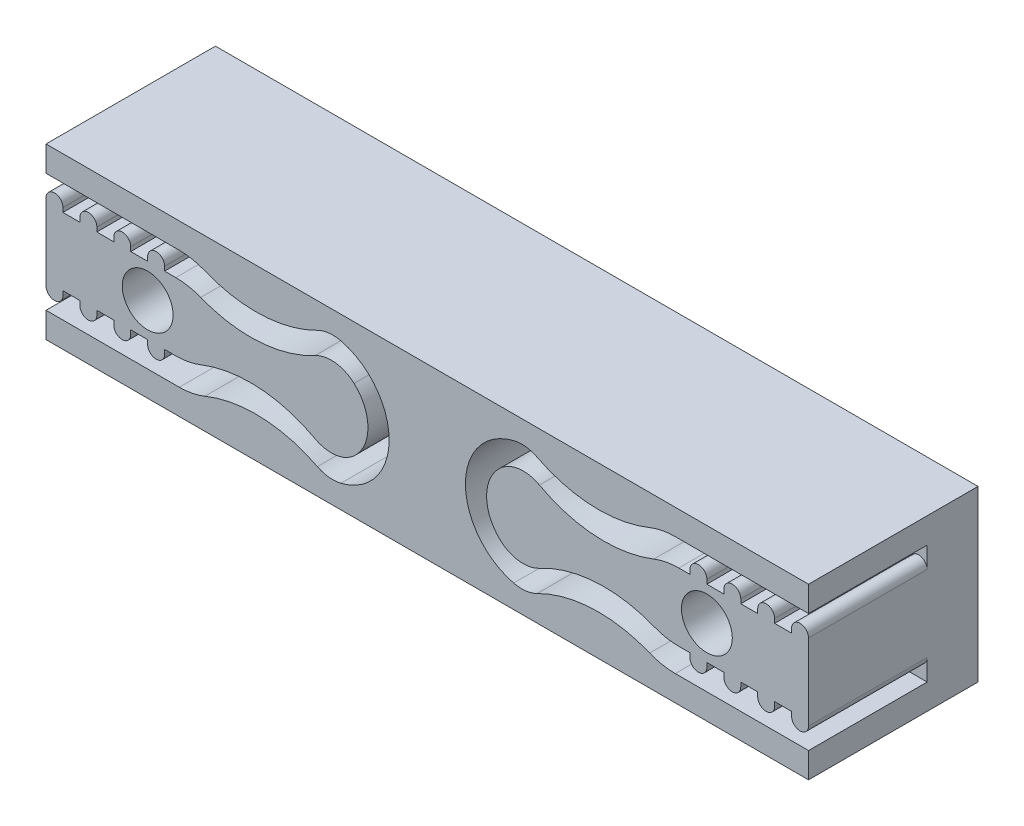
from build123d import *

# Parameters (mm, degrees)
SKETCH_1_W          = 45
SKETCH_1_H          = 8
EXTRUDE_1_DEPTH     = 10
SKETCH_4_W          = 45
SKETCH_4_H          = 10
EXTRUDE_2_DEPTH     = 2
CUT_EXTRUDE_1_DEPTH = 7
SKETCH_7_W          = 1
SKETCH_7_H          = 0.75
EXTRUDE_3_DEPTH     = 7
FILLET_2_RADIUS     = 0.5
FILLET_2_LENGTH     = 7
FILLET_3_RADIUS     = 0.5
FILLET_3_LENGTH     = 7
FILLET_4_RADIUS     = 0.5
FILLET_4_LENGTH     = 7
FILLET_5_RADIUS     = 0.5
FILLET_5_LENGTH     = 7
FILLET_7_RADIUS     = 0.5
FILLET_7_LENGTH     = 7
FILLET_8_RADIUS     = 0.5
FILLET_8_LENGTH     = 7
FILLET_9_RADIUS     = 0.5
FILLET_9_LENGTH     = 7
FILLET_10_RADIUS    = 0.5
FILLET_10_LENGTH    = 7
FILLET_11_RADIUS    = 0.5
FILLET_11_LENGTH    = 7
FILLET_12_RADIUS    = 0.5
FILLET_12_LENGTH    = 7
FILLET_13_RADIUS    = 0.5
FILLET_13_LENGTH    = 7
FILLET_14_RADIUS    = 0.5
FILLET_14_LENGTH    = 7
FILLET_15_RADIUS    = 0.5
FILLET_15_LENGTH    = 7
FILLET_16_RADIUS    = 0.5
FILLET_16_LENGTH    = 7
FILLET_17_RADIUS    = 0.5
FILLET_17_LENGTH    = 7
FILLET_18_RADIUS    = 0.5
FILLET_18_LENGTH    = 7
SKETCH_8_R          = 1.5
CUT_EXTRUDE_3_DEPTH = 26.342651795


with BuildPart() as part:
    # Эскиз1 → Бобышка-Вытянуть1 (new body)
    with BuildSketch(Plane.XY):
        Rectangle(SKETCH_1_W, SKETCH_1_H)
    extrude(amount=EXTRUDE_1_DEPTH)

    # Эскиз4 → Бобышка-Вытянуть2 (add)
    with BuildSketch(Plane(origin=(0, 4, 0), x_dir=(1, 0, 0), z_dir=(0, 1, 0))):
        with Locations((0, -5)):
            Rectangle(SKETCH_4_W, SKETCH_4_H)
    extrude(amount=EXTRUDE_2_DEPTH)

    # Эскиз6 → Вырез-Вытянуть1 (cut)
    with BuildSketch(Plane.XY.offset(10)):
        with BuildLine():
            Line((-3.5, 1), (-2.25, 1))
            ThreePointArc((-2.25, 1), (-3.046951205, 3.311277313), (-5.099068169, 4.640167831))
            ThreePointArc((-5.099068169, 4.640167831), (-5.806494099, 4.685829095), (-6.485410015, 4.481844837))
            ThreePointArc((-6.485410015, 4.481844837), (-9.775223042, 3.62120142), (-13.125305151, 4.204748078))
            ThreePointArc((-13.125305151, 4.204748078), (-13.865120501, 4.42549311), (-14.63356298, 4.5))
            Line((-14.63356298, 4.5), (-22.5, 4.5))
            Line((-22.5, 4.5), (-22.5, 3.75))
            Line((-22.5, 3.75), (-22.5, 3))
            Line((-22.5, 3), (-17, 3))
            Line((-17, 3), (-14.842076238, 3))
            ThreePointArc((-14.842076238, 3), (-14.093837358, 2.929394174), (-13.372013489, 2.720069289))
            ThreePointArc((-13.372013489, 2.720069289), (-9.949457281, 2.174767327), (-6.617441597, 3.128138563))
            ThreePointArc((-6.617441597, 3.128138563), (-5.42405994, 3.3556968), (-4.31914999, 2.850606183))
            ThreePointArc((-4.31914999, 2.850606183), (-3.713941708, 2.011897963), (-3.5, 1))
        make_face()
        with BuildLine():
            ThreePointArc((-5.099068169, -2.640167831), (-3.046951205, -1.311277313), (-2.25, 1))
            Line((-2.25, 1), (-3.5, 1))
            ThreePointArc((-3.5, 1), (-3.713941708, -0.011897963), (-4.31914999, -0.850606183))
            ThreePointArc((-4.31914999, -0.850606183), (-5.42405994, -1.3556968), (-6.617441597, -1.128138563))
            ThreePointArc((-6.617441597, -1.128138563), (-9.949457281, -0.174767327), (-13.372013489, -0.720069289))
            ThreePointArc((-13.372013489, -0.720069289), (-14.093837358, -0.929394174), (-14.842076238, -1))
            Line((-14.842076238, -1), (-17, -1))
            Line((-17, -1), (-22.5, -1))
            Line((-22.5, -1), (-22.5, -2.5))
            Line((-22.5, -2.5), (-14.63356298, -2.5))
            ThreePointArc((-14.63356298, -2.5), (-13.865120501, -2.42549311), (-13.125305151, -2.204748078))
            ThreePointArc((-13.125305151, -2.204748078), (-9.775223042, -1.62120142), (-6.485410015, -2.481844837))
            ThreePointArc((-6.485410015, -2.481844837), (-5.806494099, -2.685829095), (-5.099068169, -2.640167831))
        make_face()
        with BuildLine():
            Line((14.63356298, -2.5), (22.5, -2.5))
            Line((22.5, -2.5), (22.5, -1))
            Line((22.5, -1), (17, -1))
            Line((17, -1), (14.842076238, -1))
            ThreePointArc((14.842076238, -1), (14.093837358, -0.929394174), (13.372013489, -0.720069289))
            ThreePointArc((13.372013489, -0.720069289), (9.949457281, -0.174767327), (6.617441597, -1.128138563))
            ThreePointArc((6.617441597, -1.128138563), (5.42405994, -1.3556968), (4.31914999, -0.850606183))
            ThreePointArc((4.31914999, -0.850606183), (3.5, 1), (4.31914999, 2.850606183))
            ThreePointArc((4.31914999, 2.850606183), (5.42405994, 3.3556968), (6.617441597, 3.128138563))
            ThreePointArc((6.617441597, 3.128138563), (9.949457281, 2.174767327), (13.372013489, 2.720069289))
            ThreePointArc((13.372013489, 2.720069289), (14.093837358, 2.929394174), (14.842076238, 3))
            Line((14.842076238, 3), (17, 3))
            Line((17, 3), (22.5, 3))
            Line((22.5, 3), (22.5, 3.75))
            Line((22.5, 3.75), (22.5, 4.5))
            Line((22.5, 4.5), (14.63356298, 4.5))
            ThreePointArc((14.63356298, 4.5), (13.865120501, 4.42549311), (13.125305151, 4.204748078))
            ThreePointArc((13.125305151, 4.204748078), (9.775223042, 3.62120142), (6.485410015, 4.481844837))
            ThreePointArc((6.485410015, 4.481844837), (5.806494099, 4.685829095), (5.099068169, 4.640167831))
            ThreePointArc((5.099068169, 4.640167831), (2.25, 1), (5.099068169, -2.640167831))
            ThreePointArc((5.099068169, -2.640167831), (5.806494099, -2.685829095), (6.485410015, -2.481844837))
            ThreePointArc((6.485410015, -2.481844837), (9.775223042, -1.62120142), (13.125305151, -2.204748078))
            ThreePointArc((13.125305151, -2.204748078), (13.865120501, -2.42549311), (14.63356298, -2.5))
        make_face()
    extrude(amount=-CUT_EXTRUDE_1_DEPTH, mode=Mode.SUBTRACT)

    # Эскиз7 → Бобышка-Вытянуть3 (add)
    with BuildSketch(Plane.XY.offset(10)):
        with Locations((-22, 3.375)):
            Rectangle(SKETCH_7_W, SKETCH_7_H)
        with Locations((-20, 3.375)):
            Rectangle(SKETCH_7_W, SKETCH_7_H)
        with Locations((-18, 3.375)):
            Rectangle(SKETCH_7_W, SKETCH_7_H)
        with Locations((-16, 3.375)):
            Rectangle(SKETCH_7_W, SKETCH_7_H)
        with Locations((-22, -1.375)):
            Rectangle(SKETCH_7_W, SKETCH_7_H)
        with Locations((-20, -1.375)):
            Rectangle(SKETCH_7_W, SKETCH_7_H)
        with Locations((-18, -1.375)):
            Rectangle(SKETCH_7_W, SKETCH_7_H)
        with Locations((-16, -1.375)):
            Rectangle(SKETCH_7_W, SKETCH_7_H)
        with Locations((16, 3.375)):
            Rectangle(SKETCH_7_W, SKETCH_7_H)
        with Locations((18, 3.375)):
            Rectangle(SKETCH_7_W, SKETCH_7_H)
        with Locations((22, 3.375)):
            Rectangle(SKETCH_7_W, SKETCH_7_H)
        with Locations((22, -1.375)):
            Rectangle(SKETCH_7_W, SKETCH_7_H)
        with Locations((20, -1.375)):
            Rectangle(SKETCH_7_W, SKETCH_7_H)
        with Locations((18, -1.375)):
            Rectangle(SKETCH_7_W, SKETCH_7_H)
        with Locations((16, -1.375)):
            Rectangle(SKETCH_7_W, SKETCH_7_H)
        with Locations((20, 3.375)):
            Rectangle(SKETCH_7_W, SKETCH_7_H)
    extrude(amount=-EXTRUDE_3_DEPTH)

    # Скругление2: full round fillet: the end face becomes a half cylinder, R = half its width
    fillet_2_face = Plane((-20, 3.75, 6.5), x_dir=(0, 0, -1), z_dir=(0, 1, 0))  # on the end face: x along it, z out of the body
    fillet_2_slab = fillet_2_face.offset(-FILLET_2_RADIUS / 2) * Box(FILLET_2_LENGTH, 2 * FILLET_2_RADIUS, FILLET_2_RADIUS, mode=Mode.PRIVATE)  # the body's end, R deep
    fillet_2_round = Plane((-20, 3.25, 6.5), x_dir=(0, 1, 0), z_dir=(0, 0, -1)) * Cylinder(FILLET_2_RADIUS, FILLET_2_LENGTH, mode=Mode.PRIVATE)  # its axis R under the face
    add(fillet_2_slab - fillet_2_round, mode=Mode.SUBTRACT)

    # Скругление3: full round fillet: the end face becomes a half cylinder, R = half its width
    fillet_3_face = Plane((-18, 3.75, 6.5), x_dir=(0, 0, -1), z_dir=(0, 1, 0))  # on the end face: x along it, z out of the body
    fillet_3_slab = fillet_3_face.offset(-FILLET_3_RADIUS / 2) * Box(FILLET_3_LENGTH, 2 * FILLET_3_RADIUS, FILLET_3_RADIUS, mode=Mode.PRIVATE)  # the body's end, R deep
    fillet_3_round = Plane((-18, 3.25, 6.5), x_dir=(0, 1, 0), z_dir=(0, 0, -1)) * Cylinder(FILLET_3_RADIUS, FILLET_3_LENGTH, mode=Mode.PRIVATE)  # its axis R under the face
    add(fillet_3_slab - fillet_3_round, mode=Mode.SUBTRACT)

    # Скругление4: full round fillet: the end face becomes a half cylinder, R = half its width
    fillet_4_face = Plane((-16, 3.75, 6.5), x_dir=(0, 0, -1), z_dir=(0, 1, 0))  # on the end face: x along it, z out of the body
    fillet_4_slab = fillet_4_face.offset(-FILLET_4_RADIUS / 2) * Box(FILLET_4_LENGTH, 2 * FILLET_4_RADIUS, FILLET_4_RADIUS, mode=Mode.PRIVATE)  # the body's end, R deep
    fillet_4_round = Plane((-16, 3.25, 6.5), x_dir=(0, 1, 0), z_dir=(0, 0, -1)) * Cylinder(FILLET_4_RADIUS, FILLET_4_LENGTH, mode=Mode.PRIVATE)  # its axis R under the face
    add(fillet_4_slab - fillet_4_round, mode=Mode.SUBTRACT)

    # Скругление5: full round fillet: the end face becomes a half cylinder, R = half its width
    fillet_5_face = Plane((-22, 3.75, 6.5), x_dir=(0, 0, -1), z_dir=(0, 1, 0))  # on the end face: x along it, z out of the body
    fillet_5_slab = fillet_5_face.offset(-FILLET_5_RADIUS / 2) * Box(FILLET_5_LENGTH, 2 * FILLET_5_RADIUS, FILLET_5_RADIUS, mode=Mode.PRIVATE)  # the body's end, R deep
    fillet_5_round = Plane((-22, 3.25, 6.5), x_dir=(0, 1, 0), z_dir=(0, 0, -1)) * Cylinder(FILLET_5_RADIUS, FILLET_5_LENGTH, mode=Mode.PRIVATE)  # its axis R under the face
    add(fillet_5_slab - fillet_5_round, mode=Mode.SUBTRACT)

    # Скругление7: full round fillet: the end face becomes a half cylinder, R = half its width
    fillet_7_face = Plane((-22, -1.75, 6.5), x_dir=(0, 0, -1), z_dir=(0, -1, 0))  # on the end face: x along it, z out of the body
    fillet_7_slab = fillet_7_face.offset(-FILLET_7_RADIUS / 2) * Box(FILLET_7_LENGTH, 2 * FILLET_7_RADIUS, FILLET_7_RADIUS, mode=Mode.PRIVATE)  # the body's end, R deep
    fillet_7_round = Plane((-22, -1.25, 6.5), x_dir=(0, -1, 0), z_dir=(0, 0, -1)) * Cylinder(FILLET_7_RADIUS, FILLET_7_LENGTH, mode=Mode.PRIVATE)  # its axis R under the face
    add(fillet_7_slab - fillet_7_round, mode=Mode.SUBTRACT)

    # Скругление8: full round fillet: the end face becomes a half cylinder, R = half its width
    fillet_8_face = Plane((-20, -1.75, 6.5), x_dir=(0, 0, -1), z_dir=(0, -1, 0))  # on the end face: x along it, z out of the body
    fillet_8_slab = fillet_8_face.offset(-FILLET_8_RADIUS / 2) * Box(FILLET_8_LENGTH, 2 * FILLET_8_RADIUS, FILLET_8_RADIUS, mode=Mode.PRIVATE)  # the body's end, R deep
    fillet_8_round = Plane((-20, -1.25, 6.5), x_dir=(0, -1, 0), z_dir=(0, 0, -1)) * Cylinder(FILLET_8_RADIUS, FILLET_8_LENGTH, mode=Mode.PRIVATE)  # its axis R under the face
    add(fillet_8_slab - fillet_8_round, mode=Mode.SUBTRACT)

    # Скругление9: full round fillet: the end face becomes a half cylinder, R = half its width
    fillet_9_face = Plane((-18, -1.75, 6.5), x_dir=(0, 0, -1), z_dir=(0, -1, 0))  # on the end face: x along it, z out of the body
    fillet_9_slab = fillet_9_face.offset(-FILLET_9_RADIUS / 2) * Box(FILLET_9_LENGTH, 2 * FILLET_9_RADIUS, FILLET_9_RADIUS, mode=Mode.PRIVATE)  # the body's end, R deep
    fillet_9_round = Plane((-18, -1.25, 6.5), x_dir=(0, -1, 0), z_dir=(0, 0, -1)) * Cylinder(FILLET_9_RADIUS, FILLET_9_LENGTH, mode=Mode.PRIVATE)  # its axis R under the face
    add(fillet_9_slab - fillet_9_round, mode=Mode.SUBTRACT)

    # Скругление10: full round fillet: the end face becomes a half cylinder, R = half its width
    fillet_10_face = Plane((-16, -1.75, 6.5), x_dir=(0, 0, -1), z_dir=(0, -1, 0))  # on the end face: x along it, z out of the body
    fillet_10_slab = fillet_10_face.offset(-FILLET_10_RADIUS / 2) * Box(FILLET_10_LENGTH, 2 * FILLET_10_RADIUS, FILLET_10_RADIUS, mode=Mode.PRIVATE)  # the body's end, R deep
    fillet_10_round = Plane((-16, -1.25, 6.5), x_dir=(0, -1, 0), z_dir=(0, 0, -1)) * Cylinder(FILLET_10_RADIUS, FILLET_10_LENGTH, mode=Mode.PRIVATE)  # its axis R under the face
    add(fillet_10_slab - fillet_10_round, mode=Mode.SUBTRACT)

    # Скругление11: full round fillet: the end face becomes a half cylinder, R = half its width
    fillet_11_face = Plane((22, -1.75, 6.5), x_dir=(0, 0, 1), z_dir=(0, -1, 0))  # on the end face: x along it, z out of the body
    fillet_11_slab = fillet_11_face.offset(-FILLET_11_RADIUS / 2) * Box(FILLET_11_LENGTH, 2 * FILLET_11_RADIUS, FILLET_11_RADIUS, mode=Mode.PRIVATE)  # the body's end, R deep
    fillet_11_round = Plane((22, -1.25, 6.5), x_dir=(0, -1, 0), z_dir=(0, 0, 1)) * Cylinder(FILLET_11_RADIUS, FILLET_11_LENGTH, mode=Mode.PRIVATE)  # its axis R under the face
    add(fillet_11_slab - fillet_11_round, mode=Mode.SUBTRACT)

    # Скругление12: full round fillet: the end face becomes a half cylinder, R = half its width
    fillet_12_face = Plane((20, -1.75, 6.5), x_dir=(0, 0, 1), z_dir=(0, -1, 0))  # on the end face: x along it, z out of the body
    fillet_12_slab = fillet_12_face.offset(-FILLET_12_RADIUS / 2) * Box(FILLET_12_LENGTH, 2 * FILLET_12_RADIUS, FILLET_12_RADIUS, mode=Mode.PRIVATE)  # the body's end, R deep
    fillet_12_round = Plane((20, -1.25, 6.5), x_dir=(0, -1, 0), z_dir=(0, 0, 1)) * Cylinder(FILLET_12_RADIUS, FILLET_12_LENGTH, mode=Mode.PRIVATE)  # its axis R under the face
    add(fillet_12_slab - fillet_12_round, mode=Mode.SUBTRACT)

    # Скругление13: full round fillet: the end face becomes a half cylinder, R = half its width
    fillet_13_face = Plane((18, -1.75, 6.5), x_dir=(0, 0, 1), z_dir=(0, -1, 0))  # on the end face: x along it, z out of the body
    fillet_13_slab = fillet_13_face.offset(-FILLET_13_RADIUS / 2) * Box(FILLET_13_LENGTH, 2 * FILLET_13_RADIUS, FILLET_13_RADIUS, mode=Mode.PRIVATE)  # the body's end, R deep
    fillet_13_round = Plane((18, -1.25, 6.5), x_dir=(0, -1, 0), z_dir=(0, 0, 1)) * Cylinder(FILLET_13_RADIUS, FILLET_13_LENGTH, mode=Mode.PRIVATE)  # its axis R under the face
    add(fillet_13_slab - fillet_13_round, mode=Mode.SUBTRACT)

    # Скругление14: full round fillet: the end face becomes a half cylinder, R = half its width
    fillet_14_face = Plane((16, -1.75, 6.5), x_dir=(0, 0, 1), z_dir=(0, -1, 0))  # on the end face: x along it, z out of the body
    fillet_14_slab = fillet_14_face.offset(-FILLET_14_RADIUS / 2) * Box(FILLET_14_LENGTH, 2 * FILLET_14_RADIUS, FILLET_14_RADIUS, mode=Mode.PRIVATE)  # the body's end, R deep
    fillet_14_round = Plane((16, -1.25, 6.5), x_dir=(0, -1, 0), z_dir=(0, 0, 1)) * Cylinder(FILLET_14_RADIUS, FILLET_14_LENGTH, mode=Mode.PRIVATE)  # its axis R under the face
    add(fillet_14_slab - fillet_14_round, mode=Mode.SUBTRACT)

    # Скругление15: full round fillet: the end face becomes a half cylinder, R = half its width
    fillet_15_face = Plane((16, 3.75, 6.5), x_dir=(0, 0, 1), z_dir=(0, 1, 0))  # on the end face: x along it, z out of the body
    fillet_15_slab = fillet_15_face.offset(-FILLET_15_RADIUS / 2) * Box(FILLET_15_LENGTH, 2 * FILLET_15_RADIUS, FILLET_15_RADIUS, mode=Mode.PRIVATE)  # the body's end, R deep
    fillet_15_round = Plane((16, 3.25, 6.5), x_dir=(0, 1, 0), z_dir=(0, 0, 1)) * Cylinder(FILLET_15_RADIUS, FILLET_15_LENGTH, mode=Mode.PRIVATE)  # its axis R under the face
    add(fillet_15_slab - fillet_15_round, mode=Mode.SUBTRACT)

    # Скругление16: full round fillet: the end face becomes a half cylinder, R = half its width
    fillet_16_face = Plane((18, 3.75, 6.5), x_dir=(0, 0, 1), z_dir=(0, 1, 0))  # on the end face: x along it, z out of the body
    fillet_16_slab = fillet_16_face.offset(-FILLET_16_RADIUS / 2) * Box(FILLET_16_LENGTH, 2 * FILLET_16_RADIUS, FILLET_16_RADIUS, mode=Mode.PRIVATE)  # the body's end, R deep
    fillet_16_round = Plane((18, 3.25, 6.5), x_dir=(0, 1, 0), z_dir=(0, 0, 1)) * Cylinder(FILLET_16_RADIUS, FILLET_16_LENGTH, mode=Mode.PRIVATE)  # its axis R under the face
    add(fillet_16_slab - fillet_16_round, mode=Mode.SUBTRACT)

    # Скругление17: full round fillet: the end face becomes a half cylinder, R = half its width
    fillet_17_face = Plane((20, 3.75, 6.5), x_dir=(0, 0, -1), z_dir=(0, 1, 0))  # on the end face: x along it, z out of the body
    fillet_17_slab = fillet_17_face.offset(-FILLET_17_RADIUS / 2) * Box(FILLET_17_LENGTH, 2 * FILLET_17_RADIUS, FILLET_17_RADIUS, mode=Mode.PRIVATE)  # the body's end, R deep
    fillet_17_round = Plane((20, 3.25, 6.5), x_dir=(0, 1, 0), z_dir=(0, 0, -1)) * Cylinder(FILLET_17_RADIUS, FILLET_17_LENGTH, mode=Mode.PRIVATE)  # its axis R under the face
    add(fillet_17_slab - fillet_17_round, mode=Mode.SUBTRACT)

    # Скругление18: full round fillet: the end face becomes a half cylinder, R = half its width
    fillet_18_face = Plane((22, 3.75, 6.5), x_dir=(0, 0, 1), z_dir=(0, 1, 0))  # on the end face: x along it, z out of the body
    fillet_18_slab = fillet_18_face.offset(-FILLET_18_RADIUS / 2) * Box(FILLET_18_LENGTH, 2 * FILLET_18_RADIUS, FILLET_18_RADIUS, mode=Mode.PRIVATE)  # the body's end, R deep
    fillet_18_round = Plane((22, 3.25, 6.5), x_dir=(0, 1, 0), z_dir=(0, 0, 1)) * Cylinder(FILLET_18_RADIUS, FILLET_18_LENGTH, mode=Mode.PRIVATE)  # its axis R under the face
    add(fillet_18_slab - fillet_18_round, mode=Mode.SUBTRACT)

    # Эскиз8 → Вырез-Вытянуть3 (cut, through all)
    with BuildSketch(Plane.XY.offset(10)):
        with BuildLine():
            Line((-18, 1), (-16.5, 1))
            Line((-16.5, 1), (-15, 1))
            ThreePointArc((-15, 1), (-16.5, 2.5), (-18, 1))
        make_face()
        with BuildLine():
            Line((-15, 1), (-16.5, 1))
            Line((-16.5, 1), (-18, 1))
            ThreePointArc((-18, 1), (-16.5, -0.5), (-15, 1))
        make_face()
        with Locations((16.5, 1)):
            Circle(SKETCH_8_R)
    extrude(amount=-CUT_EXTRUDE_3_DEPTH, mode=Mode.SUBTRACT)


solid = part.part
